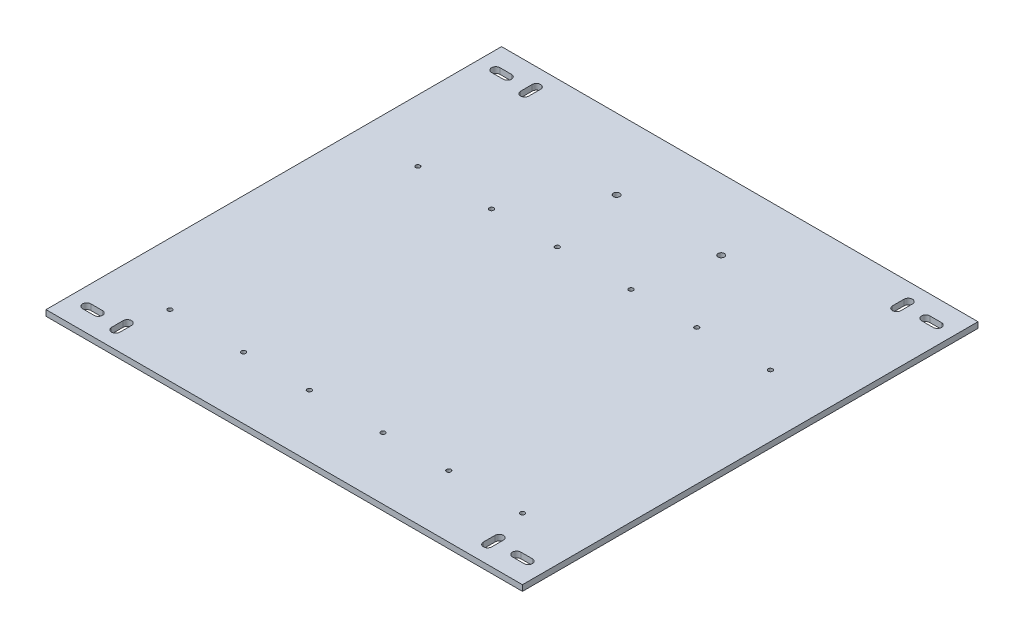
from build123d import *

# Parameters (mm, degrees)
SKETCH1_W                                = 410
SKETCH1_H                                = 392
BOSS_EXTRUDE1_DEPTH                      = 5
HOLE1_D                                  = 3.2
HOLE1_CBORE_D                            = 3.8
HOLE1_CBORE_DEPTH                        = 4
CUT_EXTRUDE2_REACH                       = 285.665
MIRROR1_AT_THE_SECOND_PLANE_COPY_1_REACH = 285.665
HOLE2_D                                  = 4.8
HOLE2_CBORE_D                            = 5.4
HOLE2_CBORE_DEPTH                        = 4


with BuildPart() as part:
    # Sketch1 → Boss-Extrude1 (new body)
    with BuildSketch(Plane(origin=(0, 0, 0), x_dir=(1, 0, 0), z_dir=(0, 1, 0))):
        Rectangle(SKETCH1_W, SKETCH1_H)
    extrude(amount=BOSS_EXTRUDE1_DEPTH)

    # Hole1 (through all)
    with Locations(Plane(origin=(0, 5, 0), x_dir=(1, 0, 0), z_dir=(0, 1, 0))):
        with Locations((-151.7, 70.7), (-88.3, 70.7), (-151.7, -142.7), (-88.3, -142.7), (-31.7, 70.7), (31.7, 70.7), (-31.7, -142.7), (31.7, -142.7), (88.3, 70.7), (151.7, 70.7), (88.3, -142.7), (151.7, -142.7)):
            CounterBoreHole(HOLE1_D / 2, HOLE1_CBORE_D / 2, HOLE1_CBORE_DEPTH)

    # Sketch2 → Cut-Extrude2 (cut, up to next)
    with BuildSketch(Plane(origin=(0, 5, 0), x_dir=(1, 0, 0), z_dir=(0, 1, 0)), mode=Mode.PRIVATE) as cut_extrude2_sk1:
        with BuildLine():
            Line((-190, -172.4), (-180, -172.4))
            ThreePointArc((-180, -172.4), (-176.4, -176), (-180, -179.6))
            Line((-180, -179.6), (-190, -179.6))
            ThreePointArc((-190, -179.6), (-193.6, -176), (-190, -172.4))
        make_face()
    cut_extrude2_tool1 = extrude(cut_extrude2_sk1.sketch, amount=-CUT_EXTRUDE2_REACH, mode=Mode.PRIVATE) & part.part
    # Sketch2 → Cut-Extrude2 (cut, up to next)
    with BuildSketch(Plane(origin=(0, 5, 0), x_dir=(1, 0, 0), z_dir=(0, 1, 0)), mode=Mode.PRIVATE) as cut_extrude2_sk2:
        with BuildLine():
            Line((-156.4, -171), (-156.4, -181))
            ThreePointArc((-156.4, -181), (-160, -184.6), (-163.6, -181))
            Line((-163.6, -181), (-163.6, -171))
            ThreePointArc((-163.6, -171), (-160, -167.4), (-156.4, -171))
        make_face()
    cut_extrude2_tool2 = extrude(cut_extrude2_sk2.sketch, amount=-CUT_EXTRUDE2_REACH, mode=Mode.PRIVATE) & part.part
    cut_extrude2_1 = cut_extrude2_tool1.solids().sort_by_distance((-185, 5, 176))[0]
    add(cut_extrude2_1, mode=Mode.SUBTRACT)
    cut_extrude2_2 = cut_extrude2_tool2.solids().sort_by_distance((-160, 5, 176))[0]
    add(cut_extrude2_2, mode=Mode.SUBTRACT)
    cut_extrude2 = cut_extrude2_1 + cut_extrude2_2  # Cut-Extrude2 as one shape, for the pattern or mirror that repeats it

    # Mirror1: Cut-Extrude2 across plane
    add(cut_extrude2.mirror(Plane(origin=(0, 0, 0), x_dir=(0, 0, 1), z_dir=(1, 0, 0))), mode=Mode.SUBTRACT)

    # Mirror1 at the second plane: Cut-Extrude2 across plane
    add(cut_extrude2.mirror(Plane.XY), mode=Mode.SUBTRACT)

    # Mirror1 at the second plane copy 1 sketc → Mirror1 at the second plane copy 1 (cut, up to next)
    with BuildSketch(Plane(origin=(0, 5, 0), x_dir=(-1, 0, 0), z_dir=(0, 1, 0)), mode=Mode.PRIVATE) as mirror1_at_the_second_plane_copy_1_sk1:
        with BuildLine():
            Line((-190, -172.4), (-180, -172.4))
            ThreePointArc((-180, -172.4), (-176.4, -176), (-180, -179.6))
            Line((-180, -179.6), (-190, -179.6))
            ThreePointArc((-190, -179.6), (-193.6, -176), (-190, -172.4))
        make_face()
    mirror1_at_the_second_plane_copy_1_tool1 = extrude(mirror1_at_the_second_plane_copy_1_sk1.sketch, amount=-MIRROR1_AT_THE_SECOND_PLANE_COPY_1_REACH, mode=Mode.PRIVATE) & part.part
    # Mirror1 at the second plane copy 1 sketc → Mirror1 at the second plane copy 1 (cut, up to next)
    with BuildSketch(Plane(origin=(0, 5, 0), x_dir=(-1, 0, 0), z_dir=(0, 1, 0)), mode=Mode.PRIVATE) as mirror1_at_the_second_plane_copy_1_sk2:
        with BuildLine():
            Line((-156.4, -171), (-156.4, -181))
            ThreePointArc((-156.4, -181), (-160, -184.6), (-163.6, -181))
            Line((-163.6, -181), (-163.6, -171))
            ThreePointArc((-163.6, -171), (-160, -167.4), (-156.4, -171))
        make_face()
    mirror1_at_the_second_plane_copy_1_tool2 = extrude(mirror1_at_the_second_plane_copy_1_sk2.sketch, amount=-MIRROR1_AT_THE_SECOND_PLANE_COPY_1_REACH, mode=Mode.PRIVATE) & part.part
    add(mirror1_at_the_second_plane_copy_1_tool1.solids().sort_by_distance((185, 5, -176))[0], mode=Mode.SUBTRACT)
    add(mirror1_at_the_second_plane_copy_1_tool2.solids().sort_by_distance((160, 5, -176))[0], mode=Mode.SUBTRACT)

    # Hole2 (through all)
    with Locations(Plane(origin=(0, 5, 0), x_dir=(1, 0, 0), z_dir=(0, 1, 0))):
        with Locations((-45, 135), (45, 135)):
            CounterBoreHole(HOLE2_D / 2, HOLE2_CBORE_D / 2, HOLE2_CBORE_DEPTH)


solid = part.part
